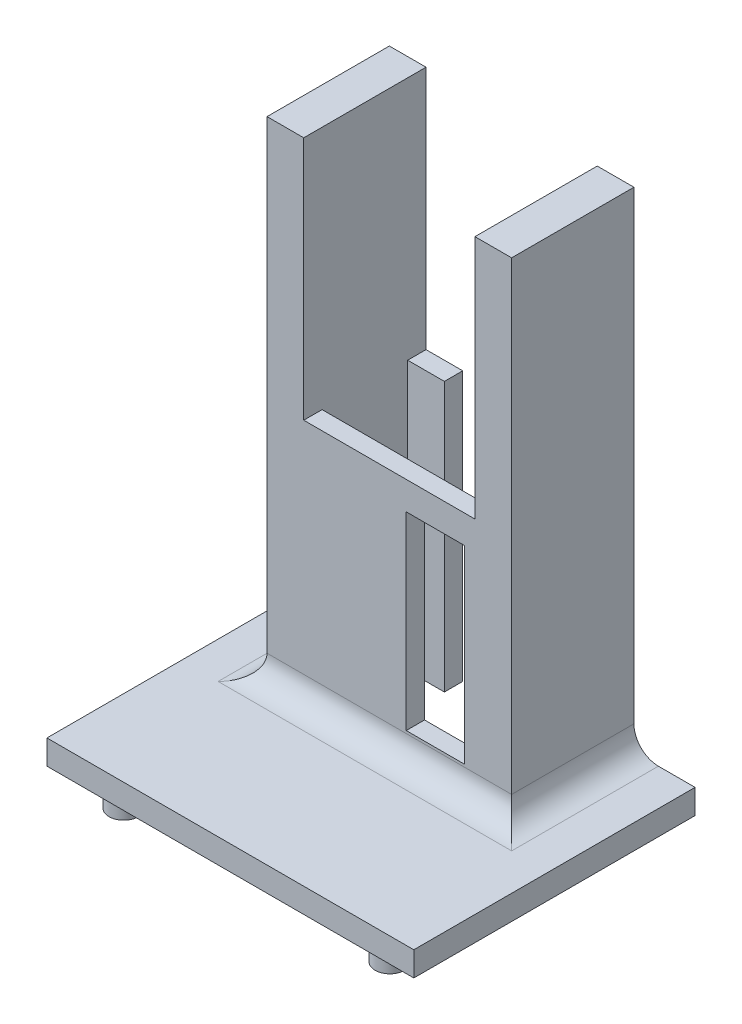
from build123d import *

# Parameters (mm, degrees)
BOSS_EXTRUDE1_DEPTH = 25.4
BOSS_EXTRUDE2_DEPTH = 2.54
FILLET1_R           = 2.54
SKETCH3_R           = 1.524
BOSS_EXTRUDE3_DEPTH = 2.54
SKETCH4_R           = 1.524
SKETCH4_W           = 3.81
SKETCH4_H           = 8.89
BOSS_EXTRUDE4_DEPTH = 2.54
CUT_EXTRUDE1_REACH  = 37.786
SKETCH5_W           = 6.027706616
SKETCH5_H           = 19.671501998
SKETCH6_W           = 3.81
SKETCH6_H           = 12.7
BOSS_EXTRUDE5_DEPTH = 25.4


with BuildPart() as part:
    # Sketch1 → Boss-Extrude1 (new body)
    with BuildSketch(Plane(origin=(0, 0, 0), x_dir=(1, 0, 0), z_dir=(0, 1, 0))):
        Polygon((-12.7, 6.35), (-5.08, 6.35), (-5.08, 4.445), (-8.89, 4.445), (-8.89, -4.445), (8.89, -4.445), (8.89, 4.445), (5.08, 4.445), (5.08, 6.35), (12.7, 6.35), (12.7, -6.35), (-12.7, -6.35), align=None)
    extrude(amount=BOSS_EXTRUDE1_DEPTH)

    # Sketch2 → Boss-Extrude2 (add)
    with BuildSketch(Plane.XZ):
        Polygon((-12.7, -6.35), (-19.05, -6.35), (-19.05, 22.86), (19.05, 22.86), (19.05, -6.35), (12.7, -6.35), (5.08, -6.35), (5.08, -4.445), (8.89, -4.445), (8.89, 4.445), (-8.89, 4.445), (-8.89, -4.445), (-5.08, -4.445), (-5.08, -6.35), align=None)
    extrude(amount=BOSS_EXTRUDE2_DEPTH)

    # Fillet1
    fillet1_edges = [part.edges().sort_by_distance(p)[0] for p in [
        (12.7, 0, 0),
        (0, 0, 6.35),
        (-12.7, 0, 0),
    ]]
    fillet(fillet1_edges, radius=FILLET1_R)

    # Sketch3 → Boss-Extrude3 (add)
    with BuildSketch(Plane.XZ.offset(2.54)):
        with Locations(Location((-13.8176, -0.4318, 0), (0, 0, 270))):
            Circle(SKETCH3_R)
    boss_extrude3 = extrude(amount=BOSS_EXTRUDE3_DEPTH)

    # Sketch4 → Boss-Extrude4 (add)
    with BuildSketch(Plane(origin=(0, -2.54, 0), x_dir=(-1, 0, 0), z_dir=(0, -1, 0))):
        with Locations(Location((13.8176, -20.1168, 0), (0, 0, 90))):
            Circle(SKETCH4_R)
        with Locations((13.8176, -10.541)):
            Rectangle(SKETCH4_W, SKETCH4_H)
    boss_extrude4 = extrude(amount=BOSS_EXTRUDE4_DEPTH)

    # Mirror1: Boss-Extrude3, Boss-Extrude4 across plane
    add(boss_extrude3.mirror(Plane(origin=(0, 0, 0), x_dir=(0, 0, 1), z_dir=(1, 0, 0))))
    add(boss_extrude4.mirror(Plane(origin=(0, 0, 0), x_dir=(0, 0, 1), z_dir=(1, 0, 0))))

    # Sketch5 → Cut-Extrude1 (cut, up to next)
    with BuildSketch(Plane.XY.offset(6.35), mode=Mode.PRIVATE) as cut_extrude1_sk1:
        with Locations((4.765146447, 12.644392592)):
            Rectangle(SKETCH5_W, SKETCH5_H)
    cut_extrude1_tool1 = extrude(cut_extrude1_sk1.sketch, amount=-CUT_EXTRUDE1_REACH, mode=Mode.PRIVATE) & part.part
    add(cut_extrude1_tool1.solids().sort_by_distance((4.765146, 12.644393, 6.35))[0], mode=Mode.SUBTRACT)

    # Sketch6 → Boss-Extrude5 (add)
    with BuildSketch(Plane(origin=(0, 25.4, 0), x_dir=(1, 0, 0), z_dir=(0, 1, 0))):
        with Locations((-10.795, 0)):
            Rectangle(SKETCH6_W, SKETCH6_H)
        with Locations((10.795, 0)):
            Rectangle(SKETCH6_W, SKETCH6_H)
    extrude(amount=BOSS_EXTRUDE5_DEPTH)


solid = part.part
